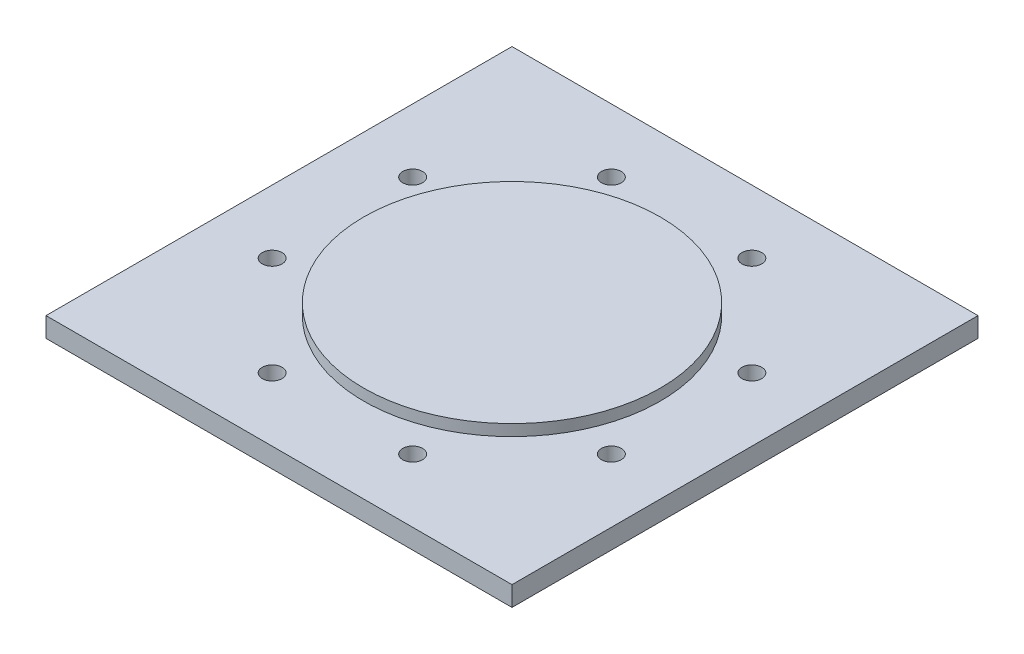
from build123d import *

# Parameters (mm, degrees)
F_01_BASE_PROFILE_W           = 330
F_01_BASE_PROFILE_H           = 330
F_01_BASE_PROFILE_R           = 7
F_01_BASE_PROFILE_R_2         = 5.248628476
F_01_BASE_PROFILE_R_3         = 5.751371524
F_01_BASE_EXTRUDE_DEPTH       = 14
F_02_BOSS_PROFILE_R           = 105
F_02_REINFORCEMENT_BOSS_DEPTH = 22


with BuildPart() as part:
    # 01_Base_Profile → 01_Base_Extrude (new body)
    with BuildSketch(Plane(origin=(0, 0, 0), x_dir=(1, 0, 0), z_dir=(0, 1, 0))):
        Rectangle(F_01_BASE_PROFILE_W, F_01_BASE_PROFILE_H)
        with Locations(Location((120.104339226, 49.748846207, 0), (0, 0, 270))):
            Circle(F_01_BASE_PROFILE_R, mode=Mode.SUBTRACT)
        with Locations(Location((49.748846207, 120.104339226, 0), (0, 0, 270))):
            Circle(F_01_BASE_PROFILE_R, mode=Mode.SUBTRACT)
        with Locations(Location((-49.748846207, 120.104339226, 0), (0, 0, 270))):
            Circle(F_01_BASE_PROFILE_R, mode=Mode.SUBTRACT)
        with Locations(Location((-120.104339226, 49.748846207, 0), (0, 0, 270))):
            Circle(F_01_BASE_PROFILE_R, mode=Mode.SUBTRACT)
        with Locations(Location((-120.104339226, -49.748846207, 0), (0, 0, 270))):
            Circle(F_01_BASE_PROFILE_R, mode=Mode.SUBTRACT)
        with Locations(Location((-49.748846207, -120.104339226, 0), (0, 0, 270))):
            Circle(F_01_BASE_PROFILE_R, mode=Mode.SUBTRACT)
        with Locations(Location((49.748846207, -120.104339226, 0), (0, 0, 270))):
            Circle(F_01_BASE_PROFILE_R, mode=Mode.SUBTRACT)
        with Locations(Location((120.104339226, -49.748846207, 0), (0, 0, 270))):
            Circle(F_01_BASE_PROFILE_R, mode=Mode.SUBTRACT)
        with Locations(Location((49.748846207, 49.748846207, 0), (0, 0, 270))):
            Circle(F_01_BASE_PROFILE_R_2, mode=Mode.SUBTRACT)
        with Locations(Location((-49.748846207, 49.748846207, 0), (0, 0, 270))):
            Circle(F_01_BASE_PROFILE_R_3, mode=Mode.SUBTRACT)
        with Locations(Location((-49.748846207, -49.748846207, 0), (0, 0, 270))):
            Circle(F_01_BASE_PROFILE_R_3, mode=Mode.SUBTRACT)
        with Locations(Location((49.748846207, -49.748846207, 0), (0, 0, 270))):
            Circle(F_01_BASE_PROFILE_R_2, mode=Mode.SUBTRACT)
    extrude(amount=F_01_BASE_EXTRUDE_DEPTH)

    # 02_Boss_Profile → 02_Reinforcement_Boss (add)
    with BuildSketch(Plane(origin=(0, 0, 0), x_dir=(1, 0, 0), z_dir=(0, 1, 0))):
        with Locations(Location((0, 0, 0), (0, 0, 90))):
            Circle(F_02_BOSS_PROFILE_R)
    extrude(amount=F_02_REINFORCEMENT_BOSS_DEPTH)


solid = part.part
